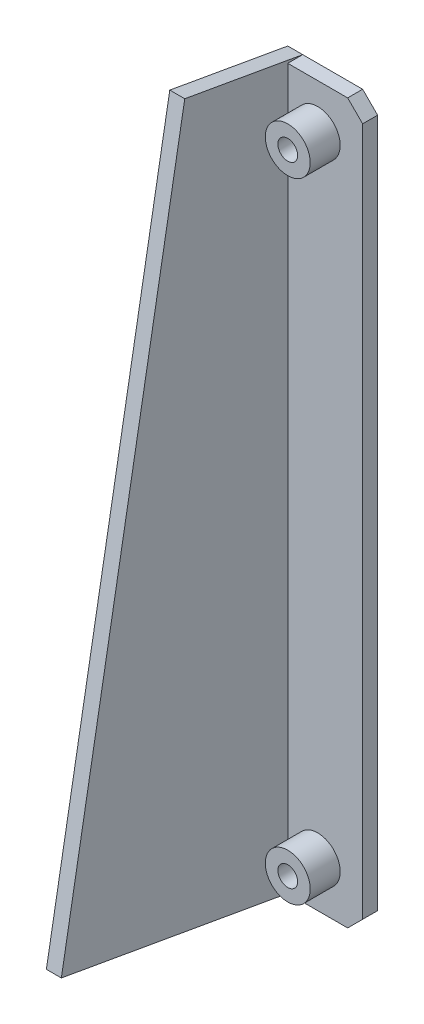
from build123d import *

# Parameters (mm, degrees)
SKETCH1_W                       = 9.525
SKETCH1_H                       = 76.2
BOSS_EXTRUDE1_DEPTH             = 1.5875
CHAMFER2_SIZE                   = 1.5875
F_97_0_0825_DIAMETER_HOLE1_D    = 2.0955
SKETCH5_R                       = 2.38125
SKETCH5_R_2                     = 1.04775
BOSS_EXTRUDE2_DEPTH             = 3.175
BOSS_EXTRUDE4_REACH             = 77.644
SKETCH7_W                       = 1.5875
SKETCH7_H                       = 75.318017262
BOSS_EXTRUDE4_DIRECTION_2_DEPTH = 12.7
CUT_EXTRUDE1_DEPTH              = 83.855524788


with BuildPart() as part:
    # Sketch1 → Boss-Extrude1 (new body)
    with BuildSketch(Plane.XY):
        with Locations((-4.7625, 38.1)):
            Rectangle(SKETCH1_W, SKETCH1_H)
    extrude(amount=BOSS_EXTRUDE1_DEPTH)

    # Chamfer2
    chamfer2_edges = [part.edges().sort_by_distance(p)[0] for p in [
        (0, 76.2, 0.79375),
        (-9.525, 76.2, 0.79375),
        (0, 0, 0.79375),
        (-9.525, 0, 0.79375),
    ]]
    chamfer(chamfer2_edges, length=CHAMFER2_SIZE)

    # #97 (0.0825) Diameter Hole1 (through all)
    with Locations(Plane.XY.offset(1.5875)):
        with Locations((-4.7625, 4.7625), (-4.7625, 71.4375)):
            Hole(F_97_0_0825_DIAMETER_HOLE1_D / 2)

    # Sketch5 → Boss-Extrude2 (add)
    # profile 1 of 2: a face of its own
    with BuildSketch(Plane.XY.offset(1.5875)):
        with Locations((-4.7625, 4.7625)):
            Circle(SKETCH5_R)
        with Locations((-4.7625, 4.7625)):
            Circle(SKETCH5_R_2, mode=Mode.SUBTRACT)
    # profile 2 of 2: a face of its own
    with BuildSketch(Plane.XY.offset(1.5875)):
        with Locations((-4.7625, 71.4375)):
            Circle(SKETCH5_R)
        with Locations((-4.7625, 71.4375)):
            Circle(SKETCH5_R_2, mode=Mode.SUBTRACT)
    extrude(amount=BOSS_EXTRUDE2_DEPTH)

    # Boss-Extrude4: up to this face of the body (flat: up to its plane)
    boss_extrude4_end = Plane(part.part.faces().sort_by_distance((-4.7625, 38.1, 0))[0])
    # Sketch7 → Boss-Extrude4 (add, up to the picked face)
    with BuildSketch(Plane(origin=(0, 2.297711148, 13.030967461), x_dir=(-1, 0, 0), z_dir=(0, -0.1736481776669307, -0.984807753012208)), mode=Mode.PRIVATE) as boss_extrude4_sk1:
        with Locations((8.73125, 37.383342149)):
            Rectangle(SKETCH7_W, SKETCH7_H)
    boss_extrude4_tool1 = split(extrude(boss_extrude4_sk1.sketch, amount=BOSS_EXTRUDE4_REACH, mode=Mode.PRIVATE), bisect_by=boss_extrude4_end, keep=Keep.BOTH, mode=Mode.PRIVATE)
    add(boss_extrude4_tool1.solids().sort_by(Axis((-8.73125, 39.113116, 6.539418), (0, -0.1736481776669307, -0.984807753012208)))[0])

    # Sketch7 → Boss-Extrude4 direction 2 (add)
    with BuildSketch(Plane(origin=(0, 2.297711148, 13.030967461), x_dir=(-1, 0, 0), z_dir=(0, -0.1736481776669307, -0.984807753012208))):
        with Locations((8.73125, 37.383342149)):
            Rectangle(SKETCH7_W, SKETCH7_H)
    extrude(amount=-BOSS_EXTRUDE4_DIRECTION_2_DEPTH)

    # Sketch9 → Cut-Extrude1 (cut, through all)
    with BuildSketch(Plane(origin=(-7.9375, 0, 0), x_dir=(0, 0, -1), z_dir=(1, 0, 0))):
        Polygon((0, 0), (-1.5875, 0), (0, -0.279919082), align=None)
    extrude(amount=-CUT_EXTRUDE1_DEPTH, mode=Mode.SUBTRACT)


solid = part.part
